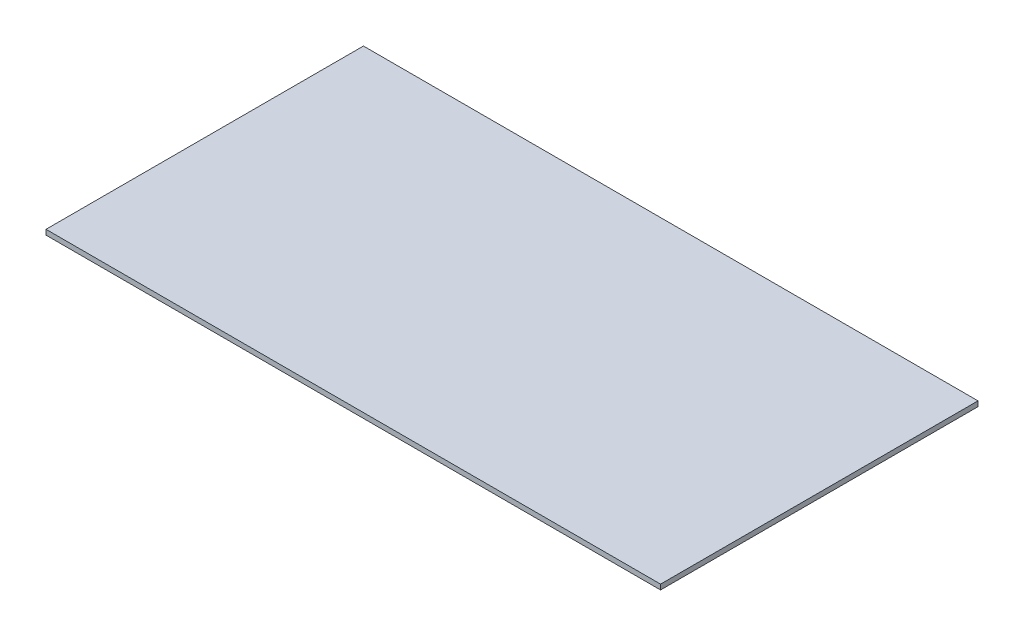
from build123d import *

# Parameters (mm, degrees)
SKETCH1_W           = 242
SKETCH1_H           = 125
BOSS_EXTRUDE1_DEPTH = 2


with BuildPart() as part:
    # Sketch1 → Boss-Extrude1 (new body)
    with BuildSketch(Plane(origin=(0, 0, 0), x_dir=(1, 0, 0), z_dir=(0, 1, 0))):
        with Locations((121, 62.5)):
            Rectangle(SKETCH1_W, SKETCH1_H)
    extrude(amount=BOSS_EXTRUDE1_DEPTH)


solid = part.part
